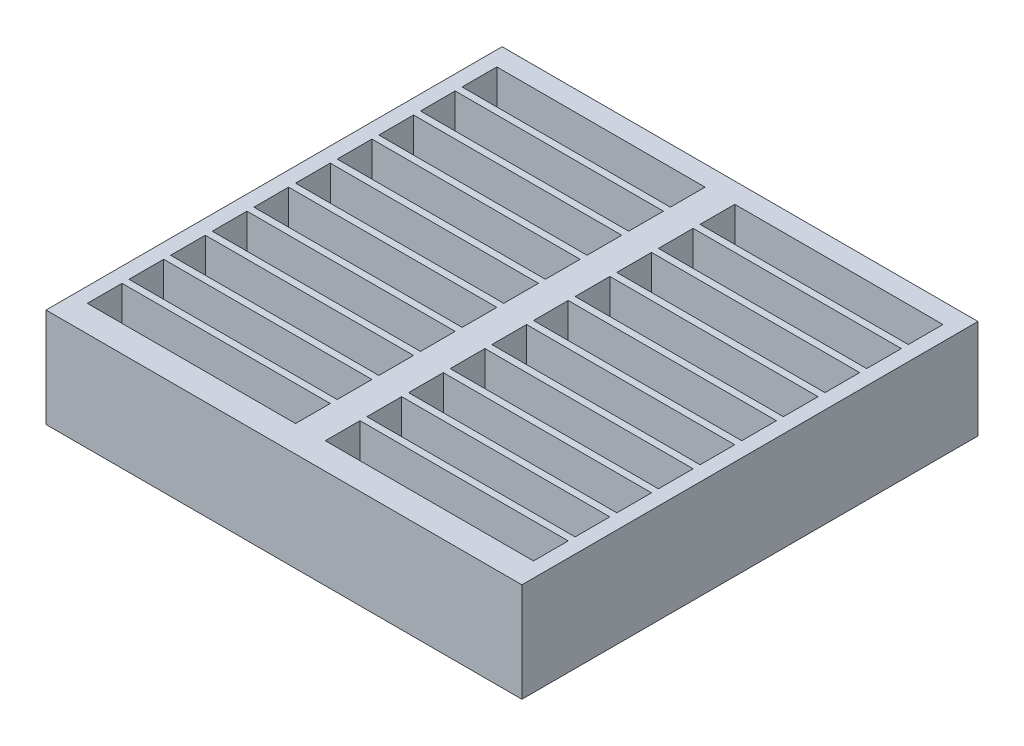
from build123d import *

# Parameters (mm, degrees)
ESQUISSE1_W             = 48
ESQUISSE1_H             = 46
BOSS_EXTRU_1_DEPTH      = 10
ESQUISSE3_W             = 21
ESQUISSE3_H             = 3.5
ENL_V_MAT_EXTRU_1_DEPTH = 10


with BuildPart() as part:
    # Esquisse1 → Boss.-Extru.1 (new body)
    with BuildSketch(Plane(origin=(0, 0, 0), x_dir=(1, 0, 0), z_dir=(0, 1, 0))):
        with Locations((24, 23)):
            Rectangle(ESQUISSE1_W, ESQUISSE1_H)
    extrude(amount=BOSS_EXTRU_1_DEPTH)

    # Esquisse3 → Enlèv. mat.-Extru.1 (cut)
    with BuildSketch(Plane(origin=(0, 10, 0), x_dir=(1, 0, 0), z_dir=(0, 1, 0))):
        with Locations((36, 4.419258555)):
            Rectangle(ESQUISSE3_W, ESQUISSE3_H)
        with Locations((36, 8.619258555)):
            Rectangle(ESQUISSE3_W, ESQUISSE3_H)
        with Locations((36, 12.819258555)):
            Rectangle(ESQUISSE3_W, ESQUISSE3_H)
        with Locations((36, 17.019258555)):
            Rectangle(ESQUISSE3_W, ESQUISSE3_H)
        with Locations((36, 21.219258555)):
            Rectangle(ESQUISSE3_W, ESQUISSE3_H)
        with Locations((36, 25.419258555)):
            Rectangle(ESQUISSE3_W, ESQUISSE3_H)
        with Locations((36, 29.619258555)):
            Rectangle(ESQUISSE3_W, ESQUISSE3_H)
        with Locations((36, 33.819258555)):
            Rectangle(ESQUISSE3_W, ESQUISSE3_H)
        with Locations((36, 38.019258555)):
            Rectangle(ESQUISSE3_W, ESQUISSE3_H)
        with Locations((36, 42.219258555)):
            Rectangle(ESQUISSE3_W, ESQUISSE3_H)
        with Locations((12, 4.419258555)):
            Rectangle(ESQUISSE3_W, ESQUISSE3_H)
        with Locations((12, 8.619258555)):
            Rectangle(ESQUISSE3_W, ESQUISSE3_H)
        with Locations((12, 12.819258555)):
            Rectangle(ESQUISSE3_W, ESQUISSE3_H)
        with Locations((12, 17.019258555)):
            Rectangle(ESQUISSE3_W, ESQUISSE3_H)
        with Locations((12, 21.219258555)):
            Rectangle(ESQUISSE3_W, ESQUISSE3_H)
        with Locations((12, 25.419258555)):
            Rectangle(ESQUISSE3_W, ESQUISSE3_H)
        with Locations((12, 29.619258555)):
            Rectangle(ESQUISSE3_W, ESQUISSE3_H)
        with Locations((12, 33.819258555)):
            Rectangle(ESQUISSE3_W, ESQUISSE3_H)
        with Locations((12, 38.019258555)):
            Rectangle(ESQUISSE3_W, ESQUISSE3_H)
        with Locations((12, 42.219258555)):
            Rectangle(ESQUISSE3_W, ESQUISSE3_H)
    extrude(amount=-ENL_V_MAT_EXTRU_1_DEPTH, mode=Mode.SUBTRACT)


solid = part.part
